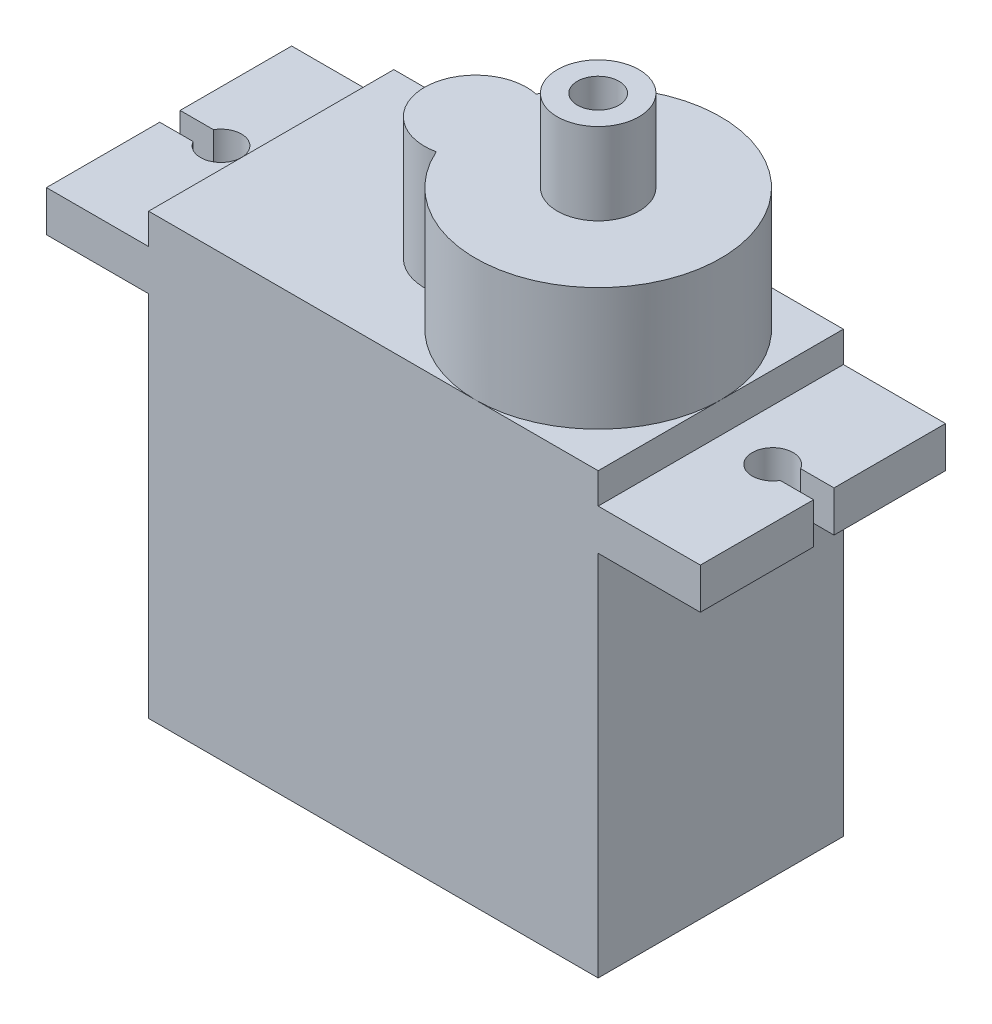
from build123d import *

# Parameters (mm, degrees)
EXTRUDE_1_DEPTH     = 12
EXTRUDE_3_DEPTH     = 6
SKETCH_4_R          = 2
EXTRUDE_4_DEPTH     = 4
CUT_EXTRUDE_2_DEPTH = 29.284271247
SKETCH_6_R          = 1.017604249
CUT_EXTRUDE_3_DEPTH = 38.312866414


with BuildPart() as part:
    # 草图1 → 凸台-拉伸1 (new body)
    with BuildSketch(Plane.XY):
        Polygon((-11, 12.536842105), (-16, 12.536842105), (-16, 14.536842105), (-11, 14.536842105), (-11, 16.036842105), (11, 16.036842105), (11, 14.536842105), (16, 14.536842105), (16, 12.536842105), (11, 12.536842105), (11, -5.463157895), (-11, -5.463157895), align=None)
    extrude(amount=EXTRUDE_1_DEPTH)

    # 草图2 → 凸台-拉伸3 (add)
    with BuildSketch(Plane(origin=(0, 16.036842105, 0), x_dir=(1, 0, 0), z_dir=(0, 1, 0))):
        with BuildLine():
            ThreePointArc((-0.479166667, -8.445144707), (11, -6), (-0.479166667, -3.554855293))
            ThreePointArc((-0.479166667, -3.554855293), (-3.5, -6), (-0.479166667, -8.445144707))
        make_face()
    extrude(amount=EXTRUDE_3_DEPTH)

    # 草图4 → 凸台-拉伸4 (add)
    with BuildSketch(Plane(origin=(0, 22.036842105, 0), x_dir=(1, 0, 0), z_dir=(0, 1, 0))):
        with Locations(Location((5, -6, 0), (0, 0, 180))):
            Circle(SKETCH_4_R)
    extrude(amount=EXTRUDE_4_DEPTH)

    # 草图5 → 切除-拉伸2 (cut, through all)
    with BuildSketch(Plane(origin=(0, 14.536842105, 0), x_dir=(-1, 0, 0), z_dir=(0, -1, 0))):
        with BuildLine():
            Line((-14.366025404, -6.458256145), (-16, -6.458256145))
            Line((-16, -6.458256145), (-16, -5.458256145))
            Line((-16, -5.458256145), (-14.366025404, -5.458256145))
            ThreePointArc((-14.366025404, -5.458256145), (-12.5, -5.958256145), (-14.366025404, -6.458256145))
        make_face()
        with BuildLine():
            Line((16, -6.458256145), (16, -5.458256145))
            Line((16, -5.458256145), (14.366025404, -5.458256145))
            ThreePointArc((14.366025404, -5.458256145), (12.5, -5.958256145), (14.366025404, -6.458256145))
            Line((14.366025404, -6.458256145), (16, -6.458256145))
        make_face()
    extrude(amount=CUT_EXTRUDE_2_DEPTH, mode=Mode.SUBTRACT)

    # 草图6 → 切除-拉伸3 (cut, through all)
    with BuildSketch(Plane(origin=(0, 26.036842105, 0), x_dir=(1, 0, 0), z_dir=(0, 1, 0))):
        with Locations(Location((5, -6, 0), (0, 0, 180))):
            Circle(SKETCH_6_R)
    extrude(amount=-CUT_EXTRUDE_3_DEPTH, mode=Mode.SUBTRACT)


solid = part.part
